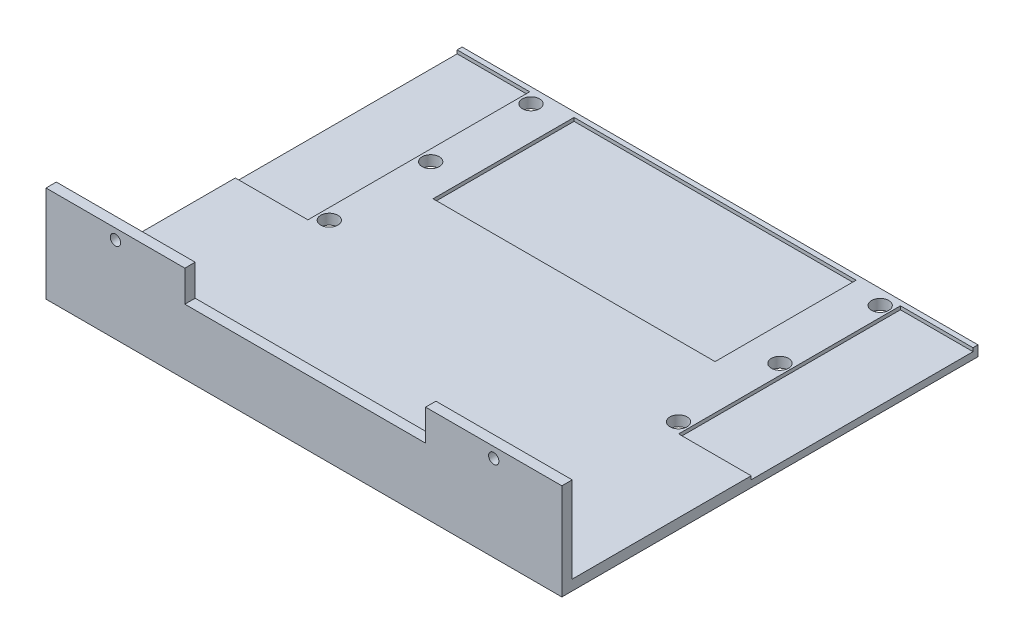
from build123d import *

# Parameters (mm, degrees)
BOSS_EXTRUDE1_DEPTH = 150
SKETCH2_W           = 70
SKETCH2_H           = 9.077653183
CUT_EXTRUDE2_DEPTH  = 3
SKETCH3_W           = 21.1
SKETCH3_H           = 64.5
CUT_EXTRUDE3_DEPTH  = 1
SKETCH4_W           = 82
SKETCH4_H           = 41
CUT_EXTRUDE4_DEPTH  = 1
SKETCH5_R           = 2.5
CUT_EXTRUDE5_DEPTH  = 3
SKETCH6_R           = 1.5
CUT_EXTRUDE6_DEPTH  = 3


with BuildPart() as part:
    # Sketch1 → Boss-Extrude1 (new body)
    with BuildSketch(Plane(origin=(0, 0, 0), x_dir=(0, 0, -1), z_dir=(1, 0, 0))):
        Polygon((-70.218878969, 2.934000234), (-70.218878969, 30.934000234), (-67.218878969, 30.934000234), (-67.218878969, 5.934000234), (50.781121031, 5.934000234), (50.781121031, 2.934000234), align=None)
    extrude(amount=-BOSS_EXTRUDE1_DEPTH)

    # Sketch2 → Cut-Extrude2 (cut)
    with BuildSketch(Plane.XY.offset(70.218878969)):
        with Locations((-74.626034168, 26.395173643)):
            Rectangle(SKETCH2_W, SKETCH2_H)
    extrude(amount=-CUT_EXTRUDE2_DEPTH, mode=Mode.SUBTRACT)

    # Sketch3 → Cut-Extrude3 (cut)
    with BuildSketch(Plane(origin=(0, 5.934000234, 0), x_dir=(1, 0, 0), z_dir=(0, 1, 0))):
        with Locations((-10.55, 17.081121031)):
            Rectangle(SKETCH3_W, SKETCH3_H)
        with Locations((-139.45, 17.081121031)):
            Rectangle(SKETCH3_W, SKETCH3_H)
    extrude(amount=-CUT_EXTRUDE3_DEPTH, mode=Mode.SUBTRACT)

    # Sketch4 → Cut-Extrude4 (cut)
    with BuildSketch(Plane(origin=(0, 5.934000234, 0), x_dir=(1, 0, 0), z_dir=(0, 1, 0))):
        with Locations((-75, 28.831121031)):
            Rectangle(SKETCH4_W, SKETCH4_H)
    extrude(amount=-CUT_EXTRUDE4_DEPTH, mode=Mode.SUBTRACT)

    # Sketch5 → Cut-Extrude5 (cut)
    with BuildSketch(Plane(origin=(0, 5.934000234, 0), x_dir=(1, 0, 0), z_dir=(0, 1, 0))):
        with Locations(Location((-24.143437735, -12.14833258, 0), (0, 0, 270))):
            Circle(SKETCH5_R)
        with Locations(Location((-24.143437735, 46.482481241, 0), (0, 0, 270))):
            Circle(SKETCH5_R)
        with Locations(Location((-24.143437735, 17.329037904, 0), (0, 0, 270))):
            Circle(SKETCH5_R)
        with Locations(Location((-125.69459869, 46.482481241, 0), (0, 0, 270))):
            Circle(SKETCH5_R)
        with Locations(Location((-125.69459869, 17.329037904, 0), (0, 0, 270))):
            Circle(SKETCH5_R)
        with Locations(Location((-125.69459869, -12.14833258, 0), (0, 0, 270))):
            Circle(SKETCH5_R)
    extrude(amount=-CUT_EXTRUDE5_DEPTH, mode=Mode.SUBTRACT)

    # Sketch6 → Cut-Extrude6 (cut)
    with BuildSketch(Plane.XY.offset(70.218878969)):
        with Locations((-129.813017084, 27.934000234)):
            Circle(SKETCH6_R)
        with Locations((-19.813017084, 27.934000234)):
            Circle(SKETCH6_R)
    extrude(amount=-CUT_EXTRUDE6_DEPTH, mode=Mode.SUBTRACT)


solid = part.part
